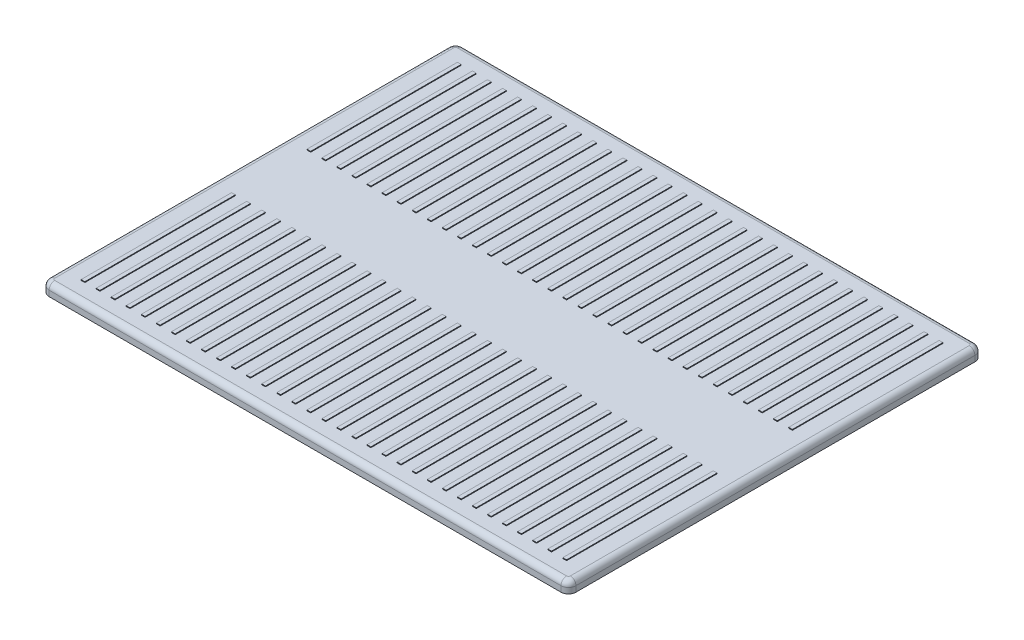
from build123d import *

# Parameters (mm, degrees)
BOSS_EXTRUDE1_DEPTH      = 1.5
FILLET1_R                = 0.75
SKETCH2_W                = 0.5
SKETCH2_H                = 20
BOSS_EXTRUDE2_DEPTH      = 0.1
LPATTERN1_COUNT          = 17
LPATTERN1_PITCH          = 2
LPATTERN1_COL_COUNT      = 17
LPATTERN1_COL_PITCH      = 2
MIRROR1_COPY_1_SKETCH_W  = 0.5
MIRROR1_COPY_1_SKETCH_H  = 20
MIRROR1_COPY_1_DEPTH     = 0.1
MIRROR1_COPY_2_SKETCH_W  = 0.5
MIRROR1_COPY_2_SKETCH_H  = 20
MIRROR1_COPY_2_DEPTH     = 0.1
MIRROR1_COPY_3_SKETCH_W  = 0.5
MIRROR1_COPY_3_SKETCH_H  = 20
MIRROR1_COPY_3_DEPTH     = 0.1
MIRROR1_COPY_4_SKETCH_W  = 0.5
MIRROR1_COPY_4_SKETCH_H  = 20
MIRROR1_COPY_4_DEPTH     = 0.1
MIRROR1_COPY_5_SKETCH_W  = 0.5
MIRROR1_COPY_5_SKETCH_H  = 20
MIRROR1_COPY_5_DEPTH     = 0.1
MIRROR1_COPY_6_SKETCH_W  = 0.5
MIRROR1_COPY_6_SKETCH_H  = 20
MIRROR1_COPY_6_DEPTH     = 0.1
MIRROR1_COPY_7_SKETCH_W  = 0.5
MIRROR1_COPY_7_SKETCH_H  = 20
MIRROR1_COPY_7_DEPTH     = 0.1
MIRROR1_COPY_8_SKETCH_W  = 0.5
MIRROR1_COPY_8_SKETCH_H  = 20
MIRROR1_COPY_8_DEPTH     = 0.1
MIRROR1_COPY_9_SKETCH_W  = 0.5
MIRROR1_COPY_9_SKETCH_H  = 20
MIRROR1_COPY_9_DEPTH     = 0.1
MIRROR1_COPY_10_SKETCH_W = 0.5
MIRROR1_COPY_10_SKETCH_H = 20
MIRROR1_COPY_10_DEPTH    = 0.1
MIRROR1_COPY_11_SKETCH_W = 0.5
MIRROR1_COPY_11_SKETCH_H = 20
MIRROR1_COPY_11_DEPTH    = 0.1
MIRROR1_COPY_12_SKETCH_W = 0.5
MIRROR1_COPY_12_SKETCH_H = 20
MIRROR1_COPY_12_DEPTH    = 0.1
MIRROR1_COPY_13_SKETCH_W = 0.5
MIRROR1_COPY_13_SKETCH_H = 20
MIRROR1_COPY_13_DEPTH    = 0.1
MIRROR1_COPY_14_SKETCH_W = 0.5
MIRROR1_COPY_14_SKETCH_H = 20
MIRROR1_COPY_14_DEPTH    = 0.1
MIRROR1_COPY_15_SKETCH_W = 0.5
MIRROR1_COPY_15_SKETCH_H = 20
MIRROR1_COPY_15_DEPTH    = 0.1
MIRROR1_COPY_16_SKETCH_W = 0.5
MIRROR1_COPY_16_SKETCH_H = 20
MIRROR1_COPY_16_DEPTH    = 0.1
MIRROR1_COPY_17_SKETCH_W = 0.5
MIRROR1_COPY_17_SKETCH_H = 20
MIRROR1_COPY_17_DEPTH    = 0.1
MIRROR1_COPY_18_SKETCH_W = 0.5
MIRROR1_COPY_18_SKETCH_H = 20
MIRROR1_COPY_18_DEPTH    = 0.1
MIRROR1_COPY_19_SKETCH_W = 0.5
MIRROR1_COPY_19_SKETCH_H = 20
MIRROR1_COPY_19_DEPTH    = 0.1
MIRROR1_COPY_20_SKETCH_W = 0.5
MIRROR1_COPY_20_SKETCH_H = 20
MIRROR1_COPY_20_DEPTH    = 0.1
MIRROR1_COPY_21_SKETCH_W = 0.5
MIRROR1_COPY_21_SKETCH_H = 20
MIRROR1_COPY_21_DEPTH    = 0.1
MIRROR1_COPY_22_SKETCH_W = 0.5
MIRROR1_COPY_22_SKETCH_H = 20
MIRROR1_COPY_22_DEPTH    = 0.1
MIRROR1_COPY_23_SKETCH_W = 0.5
MIRROR1_COPY_23_SKETCH_H = 20
MIRROR1_COPY_23_DEPTH    = 0.1
MIRROR1_COPY_24_SKETCH_W = 0.5
MIRROR1_COPY_24_SKETCH_H = 20
MIRROR1_COPY_24_DEPTH    = 0.1
MIRROR1_COPY_25_SKETCH_W = 0.5
MIRROR1_COPY_25_SKETCH_H = 20
MIRROR1_COPY_25_DEPTH    = 0.1
MIRROR1_COPY_26_SKETCH_W = 0.5
MIRROR1_COPY_26_SKETCH_H = 20
MIRROR1_COPY_26_DEPTH    = 0.1
MIRROR1_COPY_27_SKETCH_W = 0.5
MIRROR1_COPY_27_SKETCH_H = 20
MIRROR1_COPY_27_DEPTH    = 0.1
MIRROR1_COPY_28_SKETCH_W = 0.5
MIRROR1_COPY_28_SKETCH_H = 20
MIRROR1_COPY_28_DEPTH    = 0.1
MIRROR1_COPY_29_SKETCH_W = 0.5
MIRROR1_COPY_29_SKETCH_H = 20
MIRROR1_COPY_29_DEPTH    = 0.1
MIRROR1_COPY_30_SKETCH_W = 0.5
MIRROR1_COPY_30_SKETCH_H = 20
MIRROR1_COPY_30_DEPTH    = 0.1
MIRROR1_COPY_31_SKETCH_W = 0.5
MIRROR1_COPY_31_SKETCH_H = 20
MIRROR1_COPY_31_DEPTH    = 0.1
MIRROR1_COPY_32_SKETCH_W = 0.5
MIRROR1_COPY_32_SKETCH_H = 20
MIRROR1_COPY_32_DEPTH    = 0.1


with BuildPart() as part:
    # Sketch1 → Boss-Extrude1 (new body)
    with BuildSketch(Plane(origin=(0, 0, 0), x_dir=(1, 0, 0), z_dir=(0, 1, 0))):
        with BuildLine():
            Line((-34, -27.5), (34, -27.5))
            ThreePointArc((34, -27.5), (34.707106781, -27.207106781), (35, -26.5))
            Line((35, -26.5), (35, 26.5))
            ThreePointArc((35, 26.5), (34.707106781, 27.207106781), (34, 27.5))
            Line((34, 27.5), (-34, 27.5))
            ThreePointArc((-34, 27.5), (-34.707106781, 27.207106781), (-35, 26.5))
            Line((-35, 26.5), (-35, -26.5))
            ThreePointArc((-35, -26.5), (-34.707106781, -27.207106781), (-34, -27.5))
        make_face()
    extrude(amount=BOSS_EXTRUDE1_DEPTH)

    # Fillet1
    fillet1_edges = [part.edges().sort_by_distance(p)[0] for p in [
        (34.707106781, 1.5, 27.207106781),
        (35, 1.5, 0),
        (34.707106781, 1.5, -27.207106781),
        (0, 1.5, -27.5),
        (-34.707106781, 1.5, -27.207106781),
        (-35, 1.5, 0),
        (-34.707106781, 1.5, 27.207106781),
        (0, 1.5, 27.5),
    ]]
    fillet(fillet1_edges, radius=FILLET1_R)

    # Sketch2 → Boss-Extrude2 (add)
    with BuildSketch(Plane(origin=(0, 1.5, 0), x_dir=(1, 0, 0), z_dir=(0, 1, 0))):
        with Locations((0, 15)):
            Rectangle(SKETCH2_W, SKETCH2_H)
    boss_extrude2 = extrude(amount=BOSS_EXTRUDE2_DEPTH)

    # LPattern1: Boss-Extrude2 ×17
    with Locations(*[(i * LPATTERN1_PITCH, 0, 0) for i in range(1, LPATTERN1_COUNT)]):
        add(boss_extrude2)

    # LPattern1 col: Boss-Extrude2 ×17
    with Locations(*[(-i * LPATTERN1_COL_PITCH, 0, 0) for i in range(1, LPATTERN1_COL_COUNT)]):
        add(boss_extrude2)

    # Mirror1: Boss-Extrude2 across plane
    add(boss_extrude2.mirror(Plane.XY))

    # Mirror1 copy 1 sketch → Mirror1 copy 1 (add)
    with BuildSketch(Plane(origin=(2, 1.5, 0), x_dir=(1, 0, 0), z_dir=(0, 1, 0))):
        with Locations((0, -15)):
            Rectangle(MIRROR1_COPY_1_SKETCH_W, MIRROR1_COPY_1_SKETCH_H)
    extrude(amount=MIRROR1_COPY_1_DEPTH)

    # Mirror1 copy 2 sketch → Mirror1 copy 2 (add)
    with BuildSketch(Plane(origin=(4, 1.5, 0), x_dir=(1, 0, 0), z_dir=(0, 1, 0))):
        with Locations((0, -15)):
            Rectangle(MIRROR1_COPY_2_SKETCH_W, MIRROR1_COPY_2_SKETCH_H)
    extrude(amount=MIRROR1_COPY_2_DEPTH)

    # Mirror1 copy 3 sketch → Mirror1 copy 3 (add)
    with BuildSketch(Plane(origin=(6, 1.5, 0), x_dir=(1, 0, 0), z_dir=(0, 1, 0))):
        with Locations((0, -15)):
            Rectangle(MIRROR1_COPY_3_SKETCH_W, MIRROR1_COPY_3_SKETCH_H)
    extrude(amount=MIRROR1_COPY_3_DEPTH)

    # Mirror1 copy 4 sketch → Mirror1 copy 4 (add)
    with BuildSketch(Plane(origin=(8, 1.5, 0), x_dir=(1, 0, 0), z_dir=(0, 1, 0))):
        with Locations((0, -15)):
            Rectangle(MIRROR1_COPY_4_SKETCH_W, MIRROR1_COPY_4_SKETCH_H)
    extrude(amount=MIRROR1_COPY_4_DEPTH)

    # Mirror1 copy 5 sketch → Mirror1 copy 5 (add)
    with BuildSketch(Plane(origin=(10, 1.5, 0), x_dir=(1, 0, 0), z_dir=(0, 1, 0))):
        with Locations((0, -15)):
            Rectangle(MIRROR1_COPY_5_SKETCH_W, MIRROR1_COPY_5_SKETCH_H)
    extrude(amount=MIRROR1_COPY_5_DEPTH)

    # Mirror1 copy 6 sketch → Mirror1 copy 6 (add)
    with BuildSketch(Plane(origin=(12, 1.5, 0), x_dir=(1, 0, 0), z_dir=(0, 1, 0))):
        with Locations((0, -15)):
            Rectangle(MIRROR1_COPY_6_SKETCH_W, MIRROR1_COPY_6_SKETCH_H)
    extrude(amount=MIRROR1_COPY_6_DEPTH)

    # Mirror1 copy 7 sketch → Mirror1 copy 7 (add)
    with BuildSketch(Plane(origin=(14, 1.5, 0), x_dir=(1, 0, 0), z_dir=(0, 1, 0))):
        with Locations((0, -15)):
            Rectangle(MIRROR1_COPY_7_SKETCH_W, MIRROR1_COPY_7_SKETCH_H)
    extrude(amount=MIRROR1_COPY_7_DEPTH)

    # Mirror1 copy 8 sketch → Mirror1 copy 8 (add)
    with BuildSketch(Plane(origin=(16, 1.5, 0), x_dir=(1, 0, 0), z_dir=(0, 1, 0))):
        with Locations((0, -15)):
            Rectangle(MIRROR1_COPY_8_SKETCH_W, MIRROR1_COPY_8_SKETCH_H)
    extrude(amount=MIRROR1_COPY_8_DEPTH)

    # Mirror1 copy 9 sketch → Mirror1 copy 9 (add)
    with BuildSketch(Plane(origin=(18, 1.5, 0), x_dir=(1, 0, 0), z_dir=(0, 1, 0))):
        with Locations((0, -15)):
            Rectangle(MIRROR1_COPY_9_SKETCH_W, MIRROR1_COPY_9_SKETCH_H)
    extrude(amount=MIRROR1_COPY_9_DEPTH)

    # Mirror1 copy 10 sketch → Mirror1 copy 10 (add)
    with BuildSketch(Plane(origin=(20, 1.5, 0), x_dir=(1, 0, 0), z_dir=(0, 1, 0))):
        with Locations((0, -15)):
            Rectangle(MIRROR1_COPY_10_SKETCH_W, MIRROR1_COPY_10_SKETCH_H)
    extrude(amount=MIRROR1_COPY_10_DEPTH)

    # Mirror1 copy 11 sketch → Mirror1 copy 11 (add)
    with BuildSketch(Plane(origin=(22, 1.5, 0), x_dir=(1, 0, 0), z_dir=(0, 1, 0))):
        with Locations((0, -15)):
            Rectangle(MIRROR1_COPY_11_SKETCH_W, MIRROR1_COPY_11_SKETCH_H)
    extrude(amount=MIRROR1_COPY_11_DEPTH)

    # Mirror1 copy 12 sketch → Mirror1 copy 12 (add)
    with BuildSketch(Plane(origin=(24, 1.5, 0), x_dir=(1, 0, 0), z_dir=(0, 1, 0))):
        with Locations((0, -15)):
            Rectangle(MIRROR1_COPY_12_SKETCH_W, MIRROR1_COPY_12_SKETCH_H)
    extrude(amount=MIRROR1_COPY_12_DEPTH)

    # Mirror1 copy 13 sketch → Mirror1 copy 13 (add)
    with BuildSketch(Plane(origin=(26, 1.5, 0), x_dir=(1, 0, 0), z_dir=(0, 1, 0))):
        with Locations((0, -15)):
            Rectangle(MIRROR1_COPY_13_SKETCH_W, MIRROR1_COPY_13_SKETCH_H)
    extrude(amount=MIRROR1_COPY_13_DEPTH)

    # Mirror1 copy 14 sketch → Mirror1 copy 14 (add)
    with BuildSketch(Plane(origin=(28, 1.5, 0), x_dir=(1, 0, 0), z_dir=(0, 1, 0))):
        with Locations((0, -15)):
            Rectangle(MIRROR1_COPY_14_SKETCH_W, MIRROR1_COPY_14_SKETCH_H)
    extrude(amount=MIRROR1_COPY_14_DEPTH)

    # Mirror1 copy 15 sketch → Mirror1 copy 15 (add)
    with BuildSketch(Plane(origin=(30, 1.5, 0), x_dir=(1, 0, 0), z_dir=(0, 1, 0))):
        with Locations((0, -15)):
            Rectangle(MIRROR1_COPY_15_SKETCH_W, MIRROR1_COPY_15_SKETCH_H)
    extrude(amount=MIRROR1_COPY_15_DEPTH)

    # Mirror1 copy 16 sketch → Mirror1 copy 16 (add)
    with BuildSketch(Plane(origin=(32, 1.5, 0), x_dir=(1, 0, 0), z_dir=(0, 1, 0))):
        with Locations((0, -15)):
            Rectangle(MIRROR1_COPY_16_SKETCH_W, MIRROR1_COPY_16_SKETCH_H)
    extrude(amount=MIRROR1_COPY_16_DEPTH)

    # Mirror1 copy 17 sketch → Mirror1 copy 17 (add)
    with BuildSketch(Plane(origin=(-2, 1.5, 0), x_dir=(1, 0, 0), z_dir=(0, 1, 0))):
        with Locations((0, -15)):
            Rectangle(MIRROR1_COPY_17_SKETCH_W, MIRROR1_COPY_17_SKETCH_H)
    extrude(amount=MIRROR1_COPY_17_DEPTH)

    # Mirror1 copy 18 sketch → Mirror1 copy 18 (add)
    with BuildSketch(Plane(origin=(-4, 1.5, 0), x_dir=(1, 0, 0), z_dir=(0, 1, 0))):
        with Locations((0, -15)):
            Rectangle(MIRROR1_COPY_18_SKETCH_W, MIRROR1_COPY_18_SKETCH_H)
    extrude(amount=MIRROR1_COPY_18_DEPTH)

    # Mirror1 copy 19 sketch → Mirror1 copy 19 (add)
    with BuildSketch(Plane(origin=(-6, 1.5, 0), x_dir=(1, 0, 0), z_dir=(0, 1, 0))):
        with Locations((0, -15)):
            Rectangle(MIRROR1_COPY_19_SKETCH_W, MIRROR1_COPY_19_SKETCH_H)
    extrude(amount=MIRROR1_COPY_19_DEPTH)

    # Mirror1 copy 20 sketch → Mirror1 copy 20 (add)
    with BuildSketch(Plane(origin=(-8, 1.5, 0), x_dir=(1, 0, 0), z_dir=(0, 1, 0))):
        with Locations((0, -15)):
            Rectangle(MIRROR1_COPY_20_SKETCH_W, MIRROR1_COPY_20_SKETCH_H)
    extrude(amount=MIRROR1_COPY_20_DEPTH)

    # Mirror1 copy 21 sketch → Mirror1 copy 21 (add)
    with BuildSketch(Plane(origin=(-10, 1.5, 0), x_dir=(1, 0, 0), z_dir=(0, 1, 0))):
        with Locations((0, -15)):
            Rectangle(MIRROR1_COPY_21_SKETCH_W, MIRROR1_COPY_21_SKETCH_H)
    extrude(amount=MIRROR1_COPY_21_DEPTH)

    # Mirror1 copy 22 sketch → Mirror1 copy 22 (add)
    with BuildSketch(Plane(origin=(-12, 1.5, 0), x_dir=(1, 0, 0), z_dir=(0, 1, 0))):
        with Locations((0, -15)):
            Rectangle(MIRROR1_COPY_22_SKETCH_W, MIRROR1_COPY_22_SKETCH_H)
    extrude(amount=MIRROR1_COPY_22_DEPTH)

    # Mirror1 copy 23 sketch → Mirror1 copy 23 (add)
    with BuildSketch(Plane(origin=(-14, 1.5, 0), x_dir=(1, 0, 0), z_dir=(0, 1, 0))):
        with Locations((0, -15)):
            Rectangle(MIRROR1_COPY_23_SKETCH_W, MIRROR1_COPY_23_SKETCH_H)
    extrude(amount=MIRROR1_COPY_23_DEPTH)

    # Mirror1 copy 24 sketch → Mirror1 copy 24 (add)
    with BuildSketch(Plane(origin=(-16, 1.5, 0), x_dir=(1, 0, 0), z_dir=(0, 1, 0))):
        with Locations((0, -15)):
            Rectangle(MIRROR1_COPY_24_SKETCH_W, MIRROR1_COPY_24_SKETCH_H)
    extrude(amount=MIRROR1_COPY_24_DEPTH)

    # Mirror1 copy 25 sketch → Mirror1 copy 25 (add)
    with BuildSketch(Plane(origin=(-18, 1.5, 0), x_dir=(1, 0, 0), z_dir=(0, 1, 0))):
        with Locations((0, -15)):
            Rectangle(MIRROR1_COPY_25_SKETCH_W, MIRROR1_COPY_25_SKETCH_H)
    extrude(amount=MIRROR1_COPY_25_DEPTH)

    # Mirror1 copy 26 sketch → Mirror1 copy 26 (add)
    with BuildSketch(Plane(origin=(-20, 1.5, 0), x_dir=(1, 0, 0), z_dir=(0, 1, 0))):
        with Locations((0, -15)):
            Rectangle(MIRROR1_COPY_26_SKETCH_W, MIRROR1_COPY_26_SKETCH_H)
    extrude(amount=MIRROR1_COPY_26_DEPTH)

    # Mirror1 copy 27 sketch → Mirror1 copy 27 (add)
    with BuildSketch(Plane(origin=(-22, 1.5, 0), x_dir=(1, 0, 0), z_dir=(0, 1, 0))):
        with Locations((0, -15)):
            Rectangle(MIRROR1_COPY_27_SKETCH_W, MIRROR1_COPY_27_SKETCH_H)
    extrude(amount=MIRROR1_COPY_27_DEPTH)

    # Mirror1 copy 28 sketch → Mirror1 copy 28 (add)
    with BuildSketch(Plane(origin=(-24, 1.5, 0), x_dir=(1, 0, 0), z_dir=(0, 1, 0))):
        with Locations((0, -15)):
            Rectangle(MIRROR1_COPY_28_SKETCH_W, MIRROR1_COPY_28_SKETCH_H)
    extrude(amount=MIRROR1_COPY_28_DEPTH)

    # Mirror1 copy 29 sketch → Mirror1 copy 29 (add)
    with BuildSketch(Plane(origin=(-26, 1.5, 0), x_dir=(1, 0, 0), z_dir=(0, 1, 0))):
        with Locations((0, -15)):
            Rectangle(MIRROR1_COPY_29_SKETCH_W, MIRROR1_COPY_29_SKETCH_H)
    extrude(amount=MIRROR1_COPY_29_DEPTH)

    # Mirror1 copy 30 sketch → Mirror1 copy 30 (add)
    with BuildSketch(Plane(origin=(-28, 1.5, 0), x_dir=(1, 0, 0), z_dir=(0, 1, 0))):
        with Locations((0, -15)):
            Rectangle(MIRROR1_COPY_30_SKETCH_W, MIRROR1_COPY_30_SKETCH_H)
    extrude(amount=MIRROR1_COPY_30_DEPTH)

    # Mirror1 copy 31 sketch → Mirror1 copy 31 (add)
    with BuildSketch(Plane(origin=(-30, 1.5, 0), x_dir=(1, 0, 0), z_dir=(0, 1, 0))):
        with Locations((0, -15)):
            Rectangle(MIRROR1_COPY_31_SKETCH_W, MIRROR1_COPY_31_SKETCH_H)
    extrude(amount=MIRROR1_COPY_31_DEPTH)

    # Mirror1 copy 32 sketch → Mirror1 copy 32 (add)
    with BuildSketch(Plane(origin=(-32, 1.5, 0), x_dir=(1, 0, 0), z_dir=(0, 1, 0))):
        with Locations((0, -15)):
            Rectangle(MIRROR1_COPY_32_SKETCH_W, MIRROR1_COPY_32_SKETCH_H)
    extrude(amount=MIRROR1_COPY_32_DEPTH)


solid = part.part
